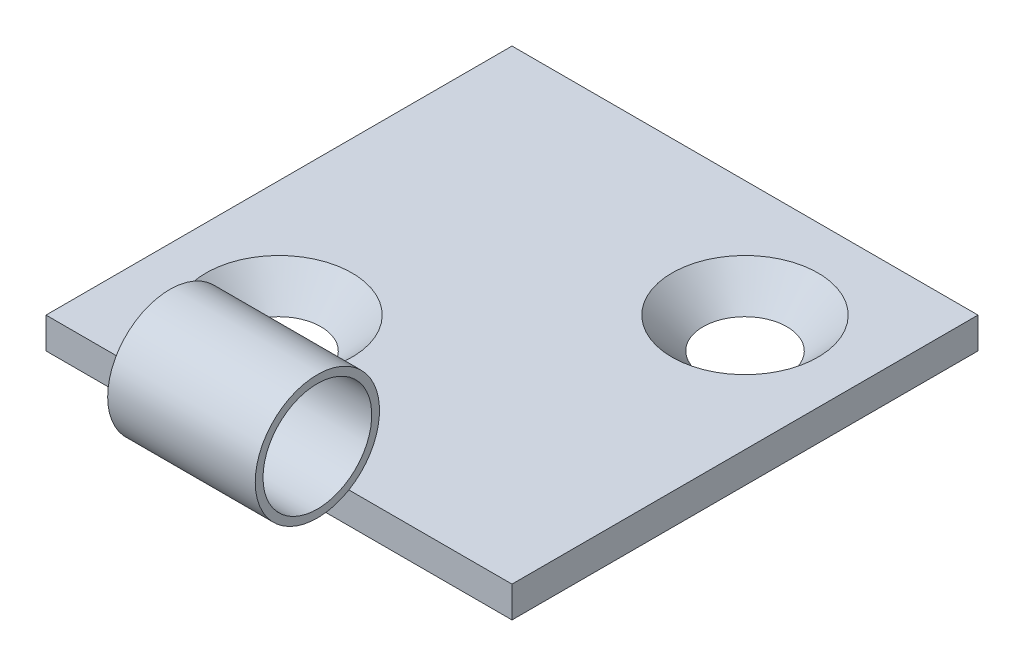
from build123d import *

# Parameters (mm, degrees)
SKETCH_1_W                 = 30
SKETCH_1_H                 = 30
EXTRUDE_1_DEPTH            = 2
SKETCH_2_R                 = 4
SKETCH_2_R_2               = 3.5
EXTRUDE_2_DEPTH            = 9.5
HOLE_WIZARD_M41_AT_2_COUNT = 2
HOLE_WIZARD_M41_AT_2_PITCH = 21.213203436


with BuildPart() as part:
    # Эскиз1 → Бобышка-Вытянуть1 (new body)
    with BuildSketch(Plane(origin=(0, 0, 0), x_dir=(1, 0, 0), z_dir=(0, 1, 0))):
        with Locations((-70.055498839, -15.11620678)):
            Rectangle(SKETCH_1_W, SKETCH_1_H)
    extrude(amount=EXTRUDE_1_DEPTH)

    # Эскиз4 → Зенковка для  винта с плоской головкой M41 (revolve, cut)
    with BuildSketch(Plane(origin=(-77.555498839, 2, 22.61620678), x_dir=(0, 0, 1), z_dir=(1, 0, 0))):
        Polygon((0, 0), (0, 22.351936393), (2.25, 21), (2.25, 2.45), (4.7, 0), align=None)
    hole_wizard_m41 = revolve(axis=Axis((-77.555498839, 8.35, 22.61620678), (0, -1, 0)), mode=Mode.SUBTRACT)

    # Зенковка для  винта с плоской головкой M41 at 2: Зенковка для  винта с плоской головкой M41 ×2
    with Locations(*[Vector(0.7071067811865479, 0, -0.7071067811865472) * (i * HOLE_WIZARD_M41_AT_2_PITCH) for i in range(1, HOLE_WIZARD_M41_AT_2_COUNT)]):
        add(hole_wizard_m41, mode=Mode.SUBTRACT)


with BuildPart() as body_2:
    # Эскиз2 → Бобышка-Вытянуть2 (new body)
    with BuildSketch(Plane.ZY.offset(75.055498839)):
        with Locations((32.14620678, 5.446607027)):
            Circle(SKETCH_2_R)
        with Locations((32.14620678, 5.446607027)):
            Circle(SKETCH_2_R_2, mode=Mode.SUBTRACT)
    extrude(amount=-EXTRUDE_2_DEPTH)


solid = Compound([part.part, body_2.part])
